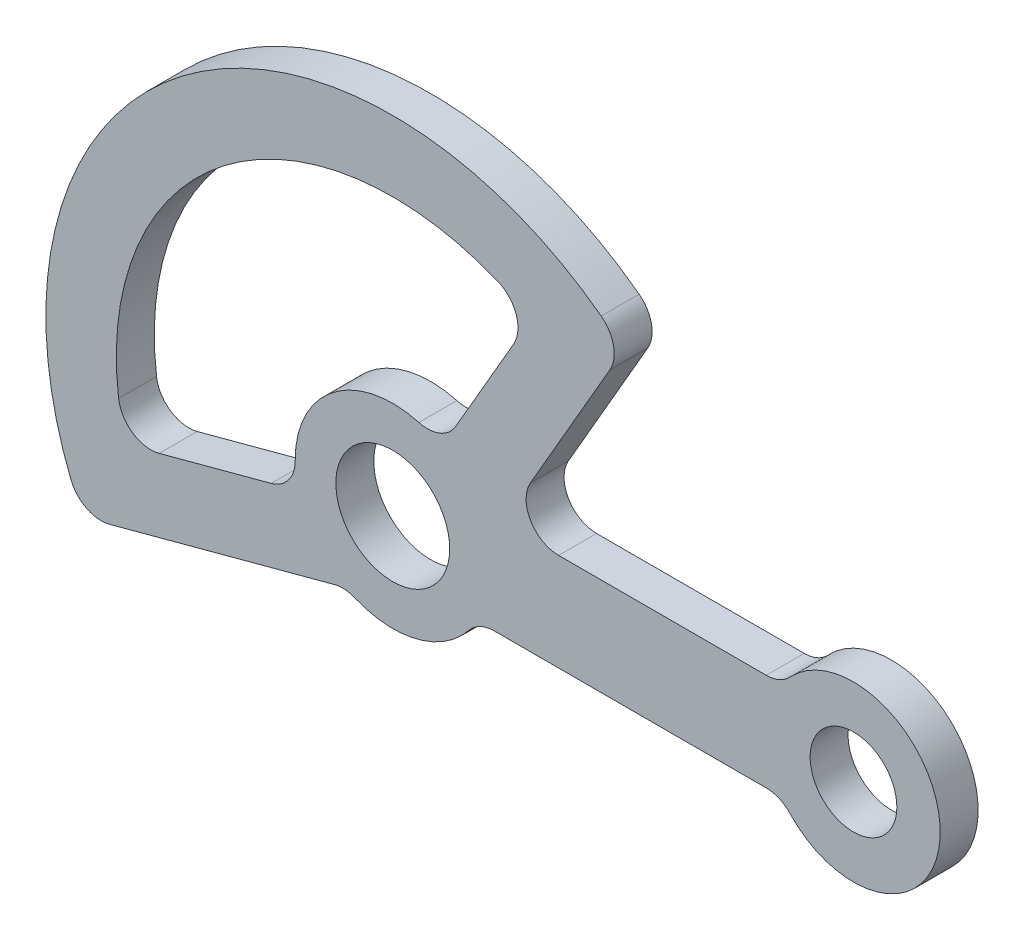
from build123d import *

# Parameters (mm, degrees)
SKETCH1_R           = 10.5
SKETCH1_R_2         = 8
BOSS_EXTRUDE1_DEPTH = 7


with BuildPart() as part:
    # Sketch1 → Boss-Extrude1 (new body)
    with BuildSketch(Plane.XY):
        with BuildLine():
            Line((-10.79860525, -16.352067901), (-52.24953322, -27.458810577))
            ThreePointArc((-52.24953322, -27.458810577), (-56.48282468, -27.031269974), (-59.368217921, -23.904282062))
            ThreePointArc((-59.368217921, -23.904282062), (-38.960731457, 50.774613779), (38.455388874, 51.158411493))
            ThreePointArc((38.455388874, 51.158411493), (40.729032534, 47.562011618), (40.04634859, 43.362310416))
            Line((40.04634859, 43.362310416), (25.403411844, 18))
            ThreePointArc((25.403411844, 18), (25.403411844, 12), (30.599564267, 9))
            Line((30.599564267, 9), (68.906523061, 9))
            ThreePointArc((68.906523061, 9), (71.299695166, 9.497934272), (73.295653135, 10.909090909))
            ThreePointArc((73.295653135, 10.909090909), (101, 0), (73.295653135, -10.909090909))
            ThreePointArc((73.295653135, -10.909090909), (71.299695166, -9.497934272), (68.906523061, -9))
            Line((68.906523061, -9), (18.734993995, -9))
            ThreePointArc((18.734993995, -9), (16.136917784, -9.591673087), (14.051245496, -11.25))
            ThreePointArc((14.051245496, -11.25), (4.455015534, -17.439978113), (-6.934268235, -16.610717144))
            ThreePointArc((-6.934268235, -16.610717144), (-8.844993295, -16.161017697), (-10.79860525, -16.352067901))
        make_face()
        Circle(SKETCH1_R, mode=Mode.SUBTRACT)
        with Locations((85, 0)):
            Circle(SKETCH1_R_2, mode=Mode.SUBTRACT)
        with BuildLine():
            Line((11.618950039, 20.124611797), (22.299103121, 38.623179569))
            ThreePointArc((22.299103121, 38.623179569), (22.781794932, 43.559859246), (19.383344125, 47.172936845))
            ThreePointArc((19.383344125, 47.172936845), (-31.046832879, 40.461020355), (-50.582336617, -6.513618221))
            ThreePointArc((-50.582336617, -6.513618221), (-47.971955445, -10.731402919), (-43.078559215, -11.542865153))
            Line((-43.078559215, -11.542865153), (-22.446087833, -6.014411108))
            ThreePointArc((-22.446087833, -6.014411108), (-19.222277472, -3.849682749), (-17.999251578, -0.164142113))
            ThreePointArc((-17.999251578, -0.164142113), (-10.957705722, 14.280360125), (4.817098212, 17.343458848))
            ThreePointArc((4.817098212, 17.343458848), (8.69359949, 17.570923037), (11.618950039, 20.124611797))
        make_face(mode=Mode.SUBTRACT)
    extrude(amount=BOSS_EXTRUDE1_DEPTH)


solid = part.part
